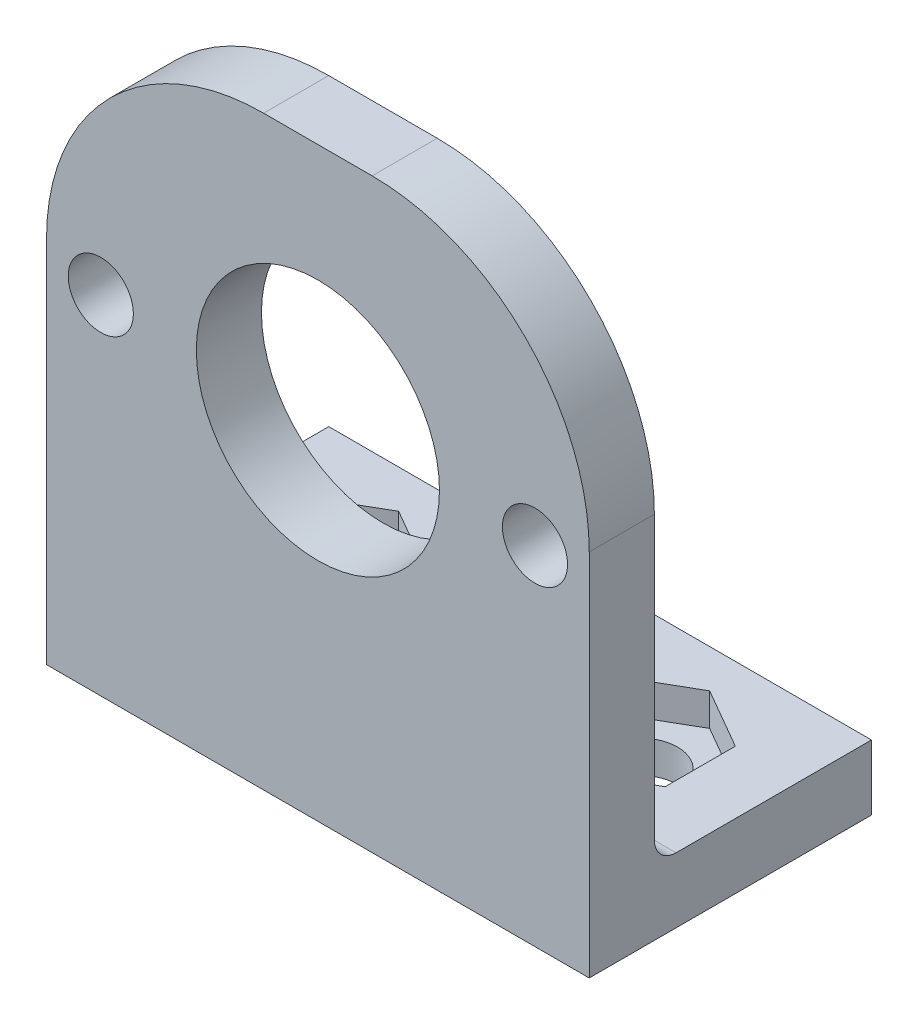
from build123d import *

# Parameters (mm, degrees)
SKETCH_1_W           = 25
SKETCH_1_H           = 27
EXTRUDE_1_DEPTH      = 3
SKETCH_2_W           = 25
SKETCH_2_H           = 2.996002967
EXTRUDE_2_DEPTH      = 10
SKETCH_3_R           = 5.6
CUT_EXTRUDE_1_DEPTH  = 10
FILLET_1_R           = 10
SKETCH_4_R           = 1.75
CUT_EXTRUDE_2_DEPTH  = 10
FILLET_2_R           = 1
CUT_EXTRUDE_3_DEPTH  = 1.5
SKETCH_6_R           = 1.5
CUT_EXTRUDE_10_DEPTH = 23.527760652


with BuildPart() as part:
    # Эскиз1 → Бобышка-Вытянуть1 (new body)
    with BuildSketch(Plane.XY):
        Rectangle(SKETCH_1_W, SKETCH_1_H)
    extrude(amount=EXTRUDE_1_DEPTH)

    # Эскиз2 → Бобышка-Вытянуть2 (add)
    with BuildSketch(Plane(origin=(0, 0, 0), x_dir=(-1, 0, 0), z_dir=(0, 0, -1))):
        with Locations((0, -12.001998517)):
            Rectangle(SKETCH_2_W, SKETCH_2_H)
    extrude(amount=EXTRUDE_2_DEPTH)

    # Эскиз3 → Вырез-Вытянуть1 (cut)
    with BuildSketch(Plane.XY.offset(3)):
        with Locations((0, 2.5)):
            Circle(SKETCH_3_R)
    extrude(amount=-CUT_EXTRUDE_1_DEPTH, mode=Mode.SUBTRACT)

    # Скругление1
    fillet_1_edges = [part.edges().sort_by_distance(p)[0] for p in [
        (-12.5, 13.5, 1.5),
        (12.5, 13.5, 1.5),
    ]]
    fillet(fillet_1_edges, radius=FILLET_1_R)

    # Эскиз4 → Вырез-Вытянуть2 (cut)
    with BuildSketch(Plane.XZ.offset(13.5)):
        with Locations(Location((-7.513385328, -5, 0), (0, 0, 270))):
            Circle(SKETCH_4_R)
        with Locations(Location((6.812780265, -5, 0), (0, 0, 270))):
            Circle(SKETCH_4_R)
    extrude(amount=-CUT_EXTRUDE_2_DEPTH, mode=Mode.SUBTRACT)

    # Скругление2
    fillet_2_edges = [part.edges().sort_by_distance(p)[0] for p in [
        (0, -10.503997033, 0),
    ]]
    fillet(fillet_2_edges, radius=FILLET_2_R)

    # Эскиз5 → Вырез-Вытянуть3 (cut)
    with BuildSketch(Plane(origin=(0, -10.503997033, 0), x_dir=(1, 0, 0), z_dir=(0, 1, 0))):
        Polygon((9.612780265, 3.383419246), (9.612780265, 6.616580754), (6.812780265, 8.233161507), (4.012780265, 6.616580754), (4.012780265, 3.383419246), (6.812780265, 1.766838493), align=None)
        Polygon((-4.713385328, 3.383419246), (-4.713385328, 6.616580754), (-7.513385328, 8.233161507), (-10.313385328, 6.616580754), (-10.313385328, 3.383419246), (-7.513385328, 1.766838493), align=None)
    extrude(amount=-CUT_EXTRUDE_3_DEPTH, mode=Mode.SUBTRACT)

    # Эскиз6 → Вырез-Вытянуть10 (cut, through all)
    with BuildSketch(Plane.XY.offset(3)):
        with Locations((-10, 2.5)):
            Circle(SKETCH_6_R)
        with Locations((10, 2.5)):
            Circle(SKETCH_6_R)
    extrude(amount=-CUT_EXTRUDE_10_DEPTH, mode=Mode.SUBTRACT)


solid = part.part
